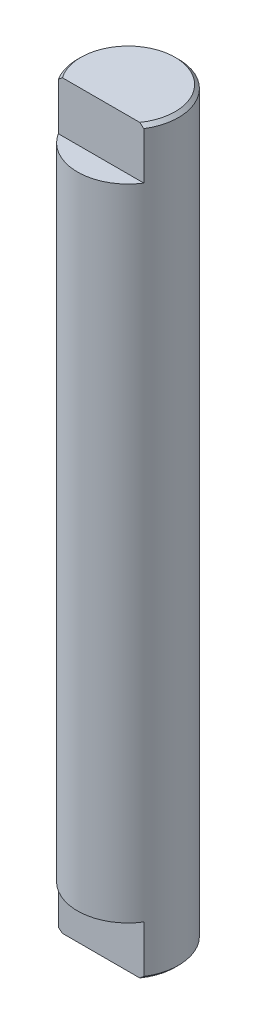
from build123d import *

# Parameters (mm, degrees)
ESQUISSE1_W             = 1.5
ESQUISSE1_H             = 22
ENL_V_MAT_EXTRU_1_DEPTH = 1.5
ENL_V_START             = -1.5
ENL_V_MAT_EXTRU_2_DEPTH = 1.5
CHANFREIN1_SIZE         = 0.1
CHANFREIN2_SIZE         = 0.1


with BuildPart() as part:
    # Esquisse1 → Révolution1 (revolve)
    with BuildSketch(Plane.XY.offset(10.4), mode=Mode.PRIVATE) as r_volution1_sk:
        with Locations((22.507807929, -2.312735583)):
            Rectangle(ESQUISSE1_W, ESQUISSE1_H)
    revolve(r_volution1_sk.sketch.rotate(Axis((21.757807929, 8.687264417, 10.4), (0, -1, 0)), 270), axis=Axis((21.757807929, 8.687264417, 10.4), (0, -1, 0)))

    # Esquisse2 → Enlèv. mat.-Extru.1 (cut)
    with BuildSketch(Plane(origin=(0, 8.687264417, 0), x_dir=(-1, 0, 0), z_dir=(0, 1, 0))):
        with BuildLine():
            Line((-23.026665683, 11.2), (-20.488950175, 11.2))
            ThreePointArc((-20.488950175, 11.2), (-21.757807929, 11.9), (-23.026665683, 11.2))
        make_face()
    extrude(amount=-ENL_V_MAT_EXTRU_1_DEPTH, mode=Mode.SUBTRACT)

    # Esquisse3 → Enlèv. mat.-Extru.2 (cut)
    with BuildSketch(Plane.XZ.offset(13.312735583).offset(ENL_V_START)):
        with BuildLine():
            Line((20.488950175, 11.2), (23.026665683, 11.2))
            ThreePointArc((23.026665683, 11.2), (21.757807929, 11.9), (20.488950175, 11.2))
        make_face()
    extrude(amount=ENL_V_MAT_EXTRU_2_DEPTH, mode=Mode.SUBTRACT)

    # Chanfrein1
    chanfrein1_edges = [part.edges().sort_by_distance(p)[0] for p in [
        (20.444415375, 8.687264417, 9.675431163),
    ]]
    chamfer(chanfrein1_edges, length=CHANFREIN1_SIZE)

    # Chanfrein2
    chanfrein2_edges = [part.edges().sort_by_distance(p)[0] for p in [
        (23.071200482, -13.312735583, 9.675431163),
    ]]
    chamfer(chanfrein2_edges, length=CHANFREIN2_SIZE)


solid = part.part
